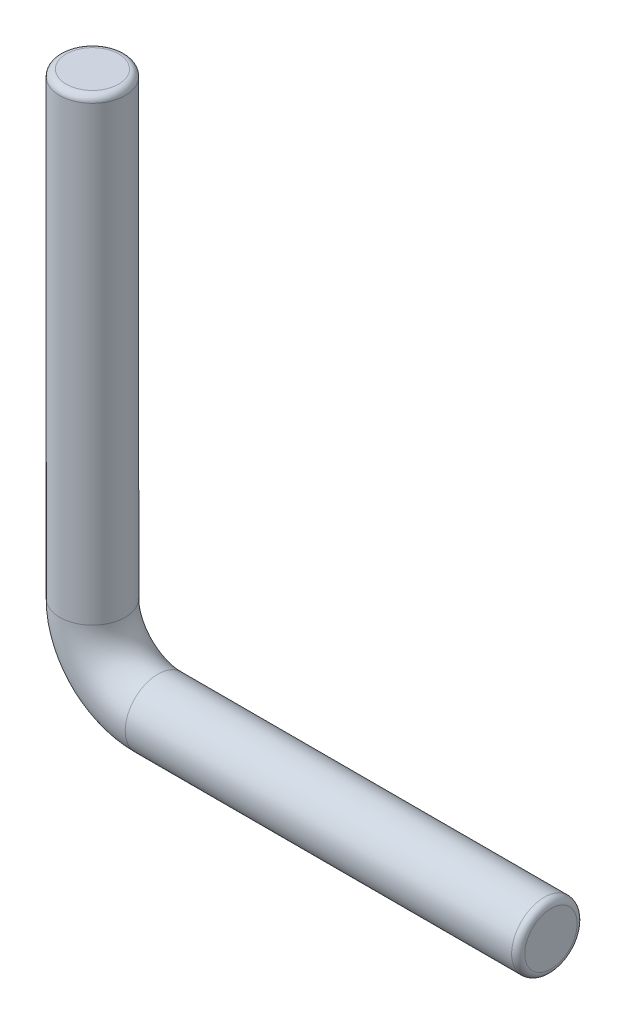
from build123d import *

# Parameters (mm, degrees)
SWEEP1_PROFILE_R = 5
FILLET1_R        = 1


with BuildPart() as part:
    # Sweep1: sweep along a path in Sketch1
    with BuildLine(Plane.XY) as sweep1_path:
        Line((70, 0), (10, 0))
        ThreePointArc((10, 0), (2.928932188, 2.928932188), (0, 10))
        Line((0, 10), (0, 80))
    # Sweep1 profile (on start of the path) → Sweep1 (sweep)
    with BuildSketch(Plane(origin=(70, 0, 0), x_dir=(0, 0, -1), z_dir=(-1, 0, 0))):
        Circle(SWEEP1_PROFILE_R)
    sweep(path=sweep1_path.line)

    # Fillet1
    fillet1_edges = [part.edges().sort_by_distance(p)[0] for p in [
        (0, 80, 5),
        (70, 0, 5),
    ]]
    fillet(fillet1_edges, radius=FILLET1_R)


solid = part.part
